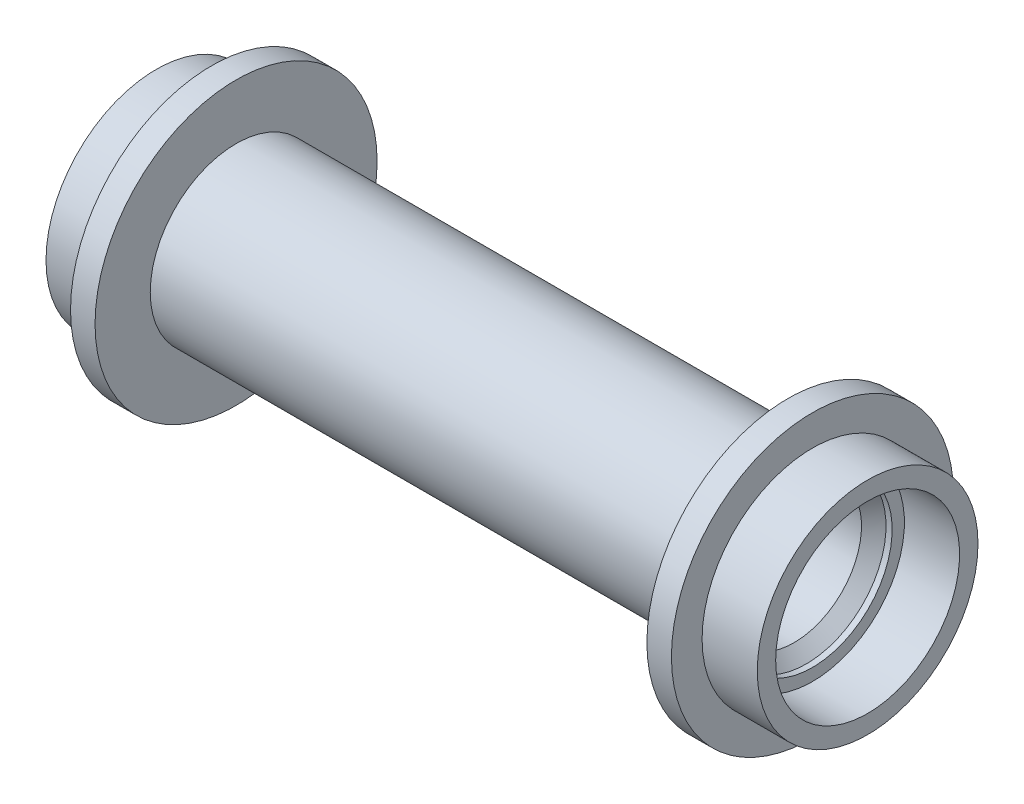
from build123d import *


with BuildPart() as part:
    # 草图1 → 旋转1 (revolve)
    with BuildSketch(Plane(origin=(0, 0, 0), x_dir=(1, 0, 0), z_dir=(0, 1, 0)), mode=Mode.PRIVATE) as revolve_1_sk:
        Polygon((0, 7), (22.5, 7), (22.5, 11.5), (24.5, 11.5), (24.5, 9), (29, 9), (29, 7.5), (24.5, 7.5), (24.5, 6.5), (24, 6.5), (23, 5.5), (0, 5.5), align=None)
    revolve_1 = revolve(revolve_1_sk.sketch.rotate(Axis((0, 0, 0), (1, 0, 0)), 180), axis=Axis((0, 0, 0), (1, 0, 0)))

    # 镜向1: 旋转1 across plane
    add(revolve_1.mirror(Plane(origin=(0, 0, -5.5), x_dir=(0, 0, 1), z_dir=(1, 0, 0))))


solid = part.part
